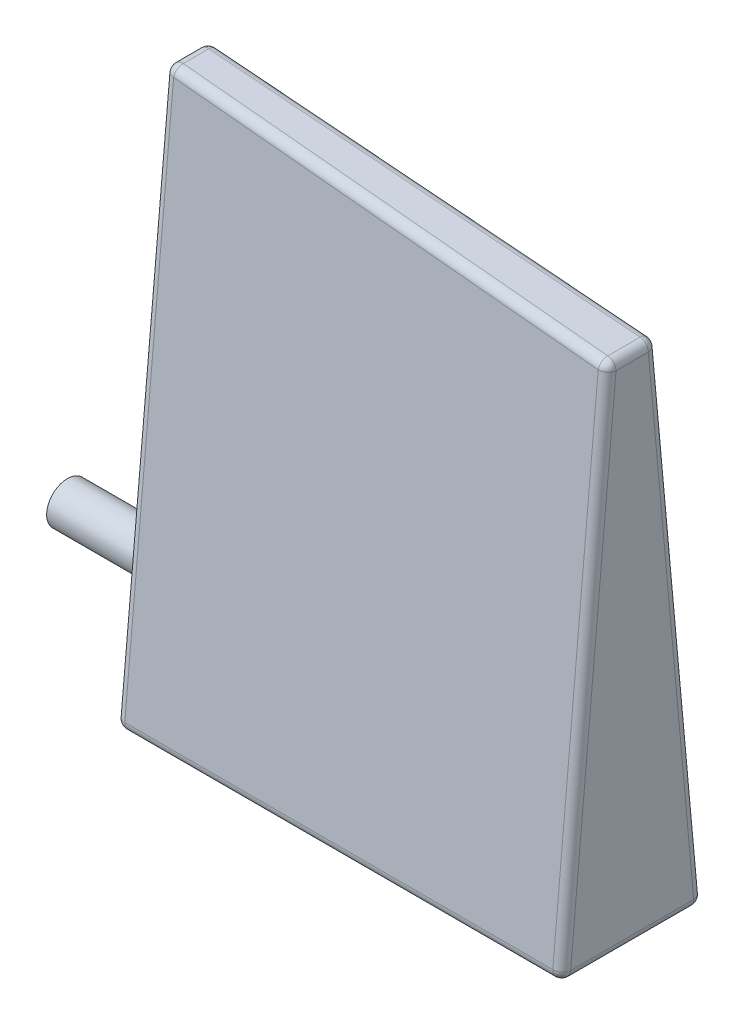
from build123d import *

# Parameters (mm, degrees)
SALIENTE_EXTRUIR1_DEPTH    = 37.5
CORTAR_EXTRUIR1_DEPTH      = 37.5
CORTAR_EXTRUIR1_DEPTH_BACK = 37.5
CROQUIS3_R                 = 1.75
SALIENTE_EXTRUIR2_DEPTH    = 10
REDONDEO1_R                = 0.75


with BuildPart() as part:
    # Croquis1 → Saliente-Extruir1 (new body)
    with BuildSketch(Plane(origin=(0, 0, 0), x_dir=(0, 0, -1), z_dir=(1, 0, 0))):
        Polygon((-6, -8.564759036), (6, -8.564759036), (1.75, 37.935240964), (-1.75, 37.935240964), align=None)
    extrude(amount=SALIENTE_EXTRUIR1_DEPTH)

    # Croquis2 → Cortar-Extruir1 (cut, two sides: drawn at the far end of the back side and taken through both)
    with BuildSketch(Plane.XY.offset(-CORTAR_EXTRUIR1_DEPTH_BACK)):
        Polygon((0, 37.935240964), (37.5, 37.935240964), (37.5, 34.654416082), align=None)
    extrude(amount=CORTAR_EXTRUIR1_DEPTH + CORTAR_EXTRUIR1_DEPTH_BACK, mode=Mode.SUBTRACT)

    # Croquis3 → Saliente-Extruir2 (add)
    with BuildSketch(Plane.ZY):
        with Locations((0, -0.064759036)):
            Circle(CROQUIS3_R)
    extrude(amount=SALIENTE_EXTRUIR2_DEPTH)

    # Redondeo1
    redondeo1_edges = [part.edges().sort_by_distance(p)[0] for p in [
        (0, -8.564759036, 0),
        (18.75, -8.564759036, -6),
        (18.75, -8.564759036, 6),
        (37.5, -8.564759036, 0),
        (37.5, 13.044828523, 4.024930169),
        (37.5, 13.044828523, -4.024930169),
        (37.5, 34.654416082, 0),
        (0, 37.935240964, 0),
        (0, 14.685240964, 3.875),
        (0, 14.685240964, -3.875),
        (18.75, 36.294828523, 1.899930169),
        (18.75, 36.294828523, -1.899930169),
    ]]
    fillet(redondeo1_edges, radius=REDONDEO1_R)


solid = part.part
